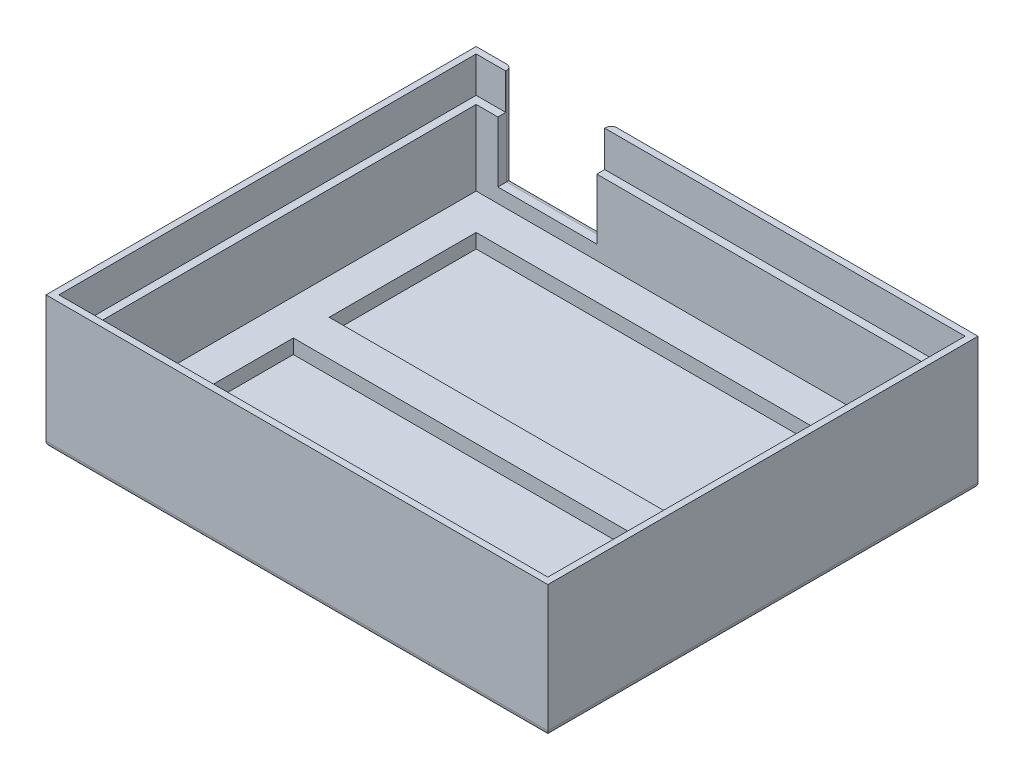
from build123d import *

# Parameters (mm, degrees)
SKETCH1_W           = 70
SKETCH1_H           = 60
BOSS_EXTRUDE1_DEPTH = 1
SKETCH2_W           = 70
SKETCH2_H           = 60
SKETCH2_W_2         = 66
SKETCH2_H_2         = 56
BOSS_EXTRUDE2_DEPTH = 17.46
SKETCH3_W           = 66
SKETCH3_H           = 56
SKETCH3_W_2         = 56
SKETCH3_H_2         = 46
BOSS_EXTRUDE4_DEPTH = 2
SKETCH4_W           = 13.208
SKETCH4_H           = 11.6586
CUT_EXTRUDE2_DEPTH  = 10
SKETCH8_W           = 56
SKETCH8_H           = 5
BOSS_EXTRUDE5_DEPTH = 2
SKETCH9_W           = 5
SKETCH9_H           = 20.5
CUT_EXTRUDE3_DEPTH  = 2
SKETCH13_W          = 68.2
SKETCH13_H          = 58.2
SKETCH13_W_2        = 66
SKETCH13_H_2        = 56
CUT_EXTRUDE6_DEPTH  = 5
FILLET1_R           = 0.8
FILLET2_R           = 0.8


with BuildPart() as part:
    # Sketch1 → Boss-Extrude1 (new body)
    with BuildSketch(Plane(origin=(0, 0, 0), x_dir=(1, 0, 0), z_dir=(0, 1, 0))):
        with Locations((12.443609023, -14.445488722)):
            Rectangle(SKETCH1_W, SKETCH1_H)
    extrude(amount=BOSS_EXTRUDE1_DEPTH)

    # Sketch2 → Boss-Extrude2 (add)
    with BuildSketch(Plane(origin=(0, 1, 0), x_dir=(1, 0, 0), z_dir=(0, 1, 0))):
        with Locations((12.443609023, -14.445488722)):
            Rectangle(SKETCH2_W, SKETCH2_H)
        with Locations((12.443609023, -14.445488722)):
            Rectangle(SKETCH2_W_2, SKETCH2_H_2, mode=Mode.SUBTRACT)
    extrude(amount=BOSS_EXTRUDE2_DEPTH)

    # Sketch3 → Boss-Extrude4 (add)
    with BuildSketch(Plane(origin=(0, 1, 0), x_dir=(1, 0, 0), z_dir=(0, 1, 0))):
        with Locations((12.443609023, -14.445488722)):
            Rectangle(SKETCH3_W, SKETCH3_H)
        with Locations((12.443609023, -14.445488722)):
            Rectangle(SKETCH3_W_2, SKETCH3_H_2, mode=Mode.SUBTRACT)
    extrude(amount=BOSS_EXTRUDE4_DEPTH)

    # Sketch4 → Cut-Extrude2 (cut)
    with BuildSketch(Plane(origin=(0, 0, -15.554511278), x_dir=(-1, 0, 0), z_dir=(0, 0, -1))):
        Polygon((3.722393626, 18.464576877), (3.722393626, 6.205976877), (3.722393626, 5.005976877), (17.530393626, 5.005976877), (17.530393626, 6.205976877), (17.530393626, 18.464576877), align=None)
        with Locations((10.626393626, 12.335276877)):
            Rectangle(SKETCH4_W, SKETCH4_H, mode=Mode.SUBTRACT)
    extrude(amount=-CUT_EXTRUDE2_DEPTH, mode=Mode.SUBTRACT)


with BuildPart() as cut_extrude2_kept_piece:
    # of the separate pieces the step leaves, the one the design keeps (cut_extrude2_pieces_kept)
    add(part.part.solids().sort_by_distance((-22.556390977, 0, -15.554511278))[0])

    # Sketch8 → Boss-Extrude5 (add)
    with BuildSketch(Plane(origin=(0, 1, 0), x_dir=(1, 0, 0), z_dir=(0, 1, 0))):
        with Locations((12.443609023, -14.445488722)):
            Rectangle(SKETCH8_W, SKETCH8_H)
    extrude(amount=BOSS_EXTRUDE5_DEPTH)

    # Sketch9 → Cut-Extrude3 (cut)
    with BuildSketch(Plane(origin=(0, 3, 0), x_dir=(1, 0, 0), z_dir=(0, 1, 0))):
        with Locations((42.943609023, -27.195488722)):
            Rectangle(SKETCH9_W, SKETCH9_H)
    extrude(amount=-CUT_EXTRUDE3_DEPTH, mode=Mode.SUBTRACT)

    # Sketch13 → Cut-Extrude6 (cut)
    with BuildSketch(Plane(origin=(0, 18.46, 0), x_dir=(1, 0, 0), z_dir=(0, 1, 0))):
        with Locations((12.443609023, -14.445488722)):
            Rectangle(SKETCH13_W, SKETCH13_H)
        with Locations((12.443609023, -14.445488722)):
            Rectangle(SKETCH13_W_2, SKETCH13_H_2, mode=Mode.SUBTRACT)
    extrude(amount=-CUT_EXTRUDE6_DEPTH, mode=Mode.SUBTRACT)

    # Fillet1
    fillet1_edges = [cut_extrude2_kept_piece.edges().sort_by_distance(p)[0] for p in [
        (12.443609023, 0, 44.445488722),
        (47.443609023, 0, 14.445488722),
        (12.443609023, 0, -15.554511278),
        (-22.556390977, 0, 14.445488722),
    ]]
    fillet(fillet1_edges, radius=FILLET1_R)

    # Fillet2
    fillet2_edges = [cut_extrude2_kept_piece.edges().sort_by_distance(p)[0] for p in [
        (-17.530393626, 11.732988439, -15.554511278),
        (-10.626393626, 5.005976877, -15.554511278),
        (-3.722393626, 11.732988439, -15.554511278),
    ]]
    fillet(fillet2_edges, radius=FILLET2_R)


solid = cut_extrude2_kept_piece.part
